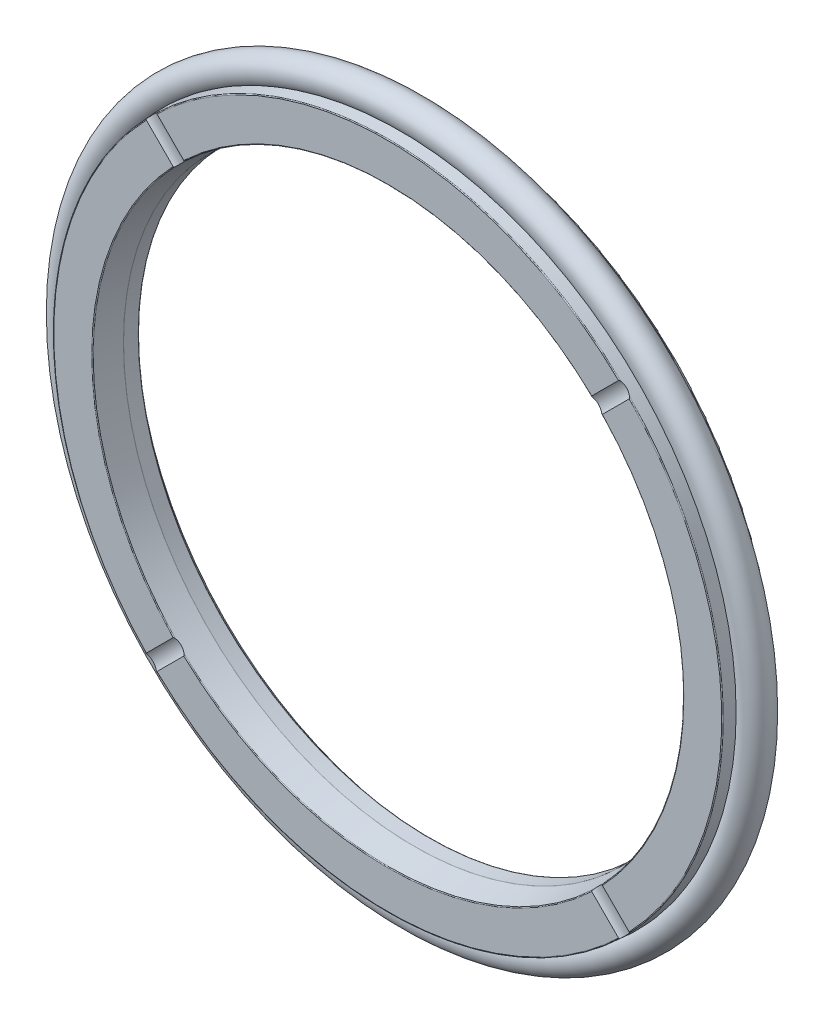
from build123d import *

# Parameters (mm, degrees)
CUT_EXTRUDE1_DEPTH = 58.543559738
CIRPATTERN1_COUNT  = 4
CUT_EXTRUDE2_DEPTH = 58.540818459
CIRPATTERN2_COUNT  = 4
SKETCH4_R          = 1.765


with BuildPart() as part:
    # Sketch1 → Revolve1 (revolve)
    with BuildSketch(Plane(origin=(0, 0, 0), x_dir=(0, 0, -1), z_dir=(1, 0, 0)), mode=Mode.PRIVATE) as revolve1_sk:
        with BuildLine():
            Line((0, 35.9), (0, 40.275))
            ThreePointArc((0, 40.275), (-0.063816828, 40.421472331), (-0.214541437, 40.474470666))
            Line((-0.214541437, 40.474470666), (-5.807270719, 40.066759977))
            ThreePointArc((-5.807270719, 40.066759977), (-5.873236165, 40.035116229), (-5.9, 39.967024644))
            Line((-5.9, 39.967024644), (-5.9, 35.434930639))
            ThreePointArc((-5.9, 35.434930639), (-5.876220014, 35.370196494), (-5.81618981, 35.336249891))
            Line((-5.81618981, 35.336249891), (-2.708041154, 34.826319252))
            ThreePointArc((-2.708041154, 34.826319252), (-2.69997308, 34.825330359), (-2.691851344, 34.825))
            Line((-2.691851344, 34.825), (-0.946698371, 34.825))
            ThreePointArc((-0.946698371, 34.825), (-0.904386237, 34.834392697), (-0.870022604, 34.860806334))
            Line((-0.870022604, 34.860806334), (0, 35.9))
        make_face()
    revolve(revolve1_sk.sketch.rotate(Axis((0, 0, 0), (0, 0, 1)), 90), axis=Axis((0, 0, 0), (0, 0, 1)))

    # Sketch2 → Cut-Extrude1 (cut, symmetric)
    with BuildSketch(Plane(origin=(0, 0, 0), x_dir=(0, 0, -1), z_dir=(1, 0, 0))):
        with BuildLine():
            Line((0, 0.9), (0, -0.9))
            ThreePointArc((0, -0.9), (-0.25, 0), (0, 0.9))
        make_face()
    cut_extrude1 = extrude(amount=CUT_EXTRUDE1_DEPTH, both=True, mode=Mode.SUBTRACT)

    # CirPattern1: Cut-Extrude1 ×4 about axis
    cirpattern1_axis = Axis((0, 0, -19.117405614), (0, 0, 1))
    for i in range(1, CIRPATTERN1_COUNT):
        add(cut_extrude1.rotate(cirpattern1_axis, i * 360 / CIRPATTERN1_COUNT), mode=Mode.SUBTRACT)

    # Sketch3 → Cut-Extrude2 (cut, symmetric)
    with BuildSketch(Plane(origin=(0, 0, 0), x_dir=(0.7071067811865488, 0.7071067811865462, 0), z_dir=(0.7071067811865462, -0.7071067811865488, 0))):
        with BuildLine():
            Line((-0.9, 5.9), (0.9, 5.9))
            ThreePointArc((0.9, 5.9), (0, 5.65), (-0.9, 5.9))
        make_face()
    cut_extrude2 = extrude(amount=CUT_EXTRUDE2_DEPTH, both=True, mode=Mode.SUBTRACT)

    # CirPattern2: Cut-Extrude2 ×4 about axis
    cirpattern2_axis = Axis((0, 0, -19.117405614), (0, 0, 1))
    for i in range(1, CIRPATTERN2_COUNT):
        add(cut_extrude2.rotate(cirpattern2_axis, i * 360 / CIRPATTERN2_COUNT), mode=Mode.SUBTRACT)


with BuildPart() as body_2:
    # Sketch4 → Revolve2 (revolve)
    with BuildSketch(Plane(origin=(0, 0, 0), x_dir=(0, 0, -1), z_dir=(1, 0, 0)), mode=Mode.PRIVATE) as revolve2_sk:
        with Locations((-3, 41.265)):
            Circle(SKETCH4_R)
    revolve(revolve2_sk.sketch.rotate(Axis((0, 0, 0), (0, 0, 1)), 89.504546805), axis=Axis((0, 0, 0), (0, 0, 1)))


solid = Compound([part.part, body_2.part])
